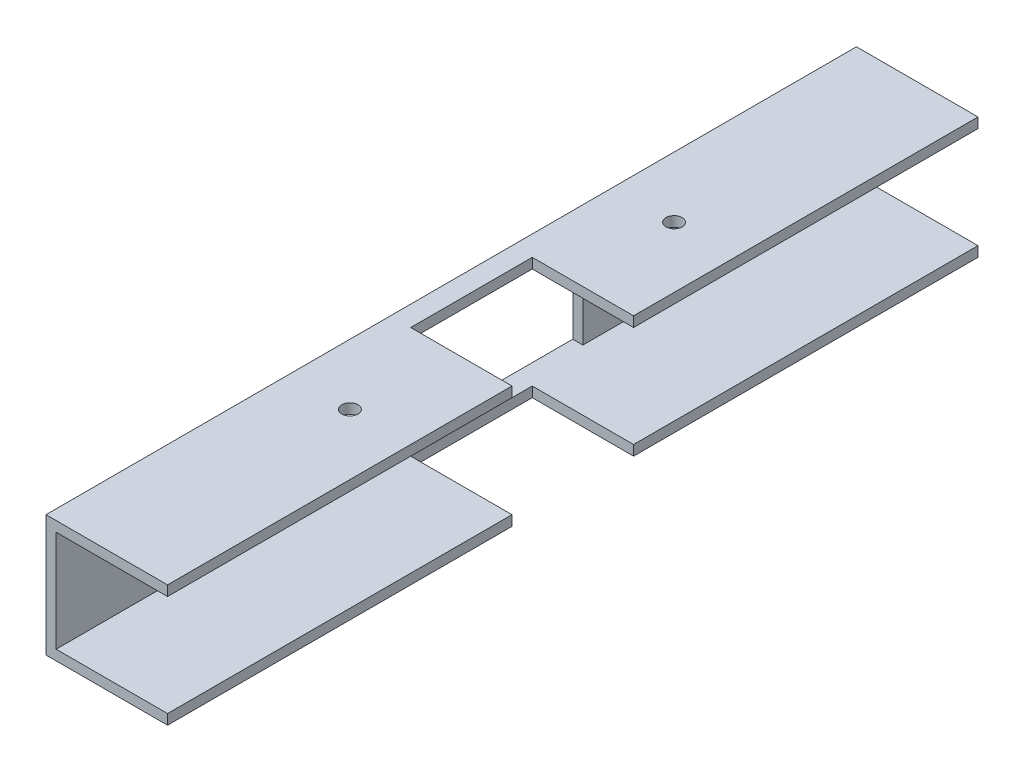
from build123d import *

# Parameters (mm, degrees)
BOSS_EXTRUDE1_DEPTH = 127
SKETCH2_W           = 31.75
SKETCH2_H           = 38.1
CUT_EXTRUDE1_DEPTH  = 134.953396747
SKETCH3_W           = 76.2
SKETCH3_H           = 31.75
CUT_EXTRUDE2_DEPTH  = 134.953396747
CUT_EXTRUDE3_REACH  = 135.953
SKETCH4_R           = 2.54


with BuildPart() as part:
    # Sketch1 → Boss-Extrude1 (new, symmetric)
    with BuildSketch(Plane.XY):
        Polygon((19.05, 19.05), (-19.05, 19.05), (-19.05, -19.05), (19.05, -19.05), (19.05, -15.875), (-15.875, -15.875), (-15.875, 15.875), (19.05, 15.875), align=None)
    extrude(amount=BOSS_EXTRUDE1_DEPTH, both=True)

    # Sketch2 → Cut-Extrude1 (cut, through all)
    with BuildSketch(Plane(origin=(0, 19.05, 0), x_dir=(1, 0, 0), z_dir=(0, 1, 0))):
        with Locations((3.175, 0)):
            Rectangle(SKETCH2_W, SKETCH2_H)
    extrude(amount=-CUT_EXTRUDE1_DEPTH, mode=Mode.SUBTRACT)

    # Sketch3 → Cut-Extrude2 (cut, through all)
    with BuildSketch(Plane.ZY.offset(19.05)):
        Rectangle(SKETCH3_W, SKETCH3_H)
    extrude(amount=-CUT_EXTRUDE2_DEPTH, mode=Mode.SUBTRACT)

    # Sketch4 → Cut-Extrude3 (cut, up to next)
    with BuildSketch(Plane(origin=(0, 19.05, 0), x_dir=(1, 0, 0), z_dir=(0, 1, 0)), mode=Mode.PRIVATE) as cut_extrude3_sk1:
        with Locations(Location((0, -50.8, 0), (0, 0, 180))):
            Circle(SKETCH4_R)
    cut_extrude3_tool1 = extrude(cut_extrude3_sk1.sketch, amount=-CUT_EXTRUDE3_REACH, mode=Mode.PRIVATE) & part.part
    cut_extrude3 = cut_extrude3_tool1.solids().sort_by_distance((0, 19.05, 50.8))[0]
    add(cut_extrude3, mode=Mode.SUBTRACT)

    # Mirror1: Cut-Extrude3 across plane
    add(cut_extrude3.mirror(Plane.XY), mode=Mode.SUBTRACT)


solid = part.part
